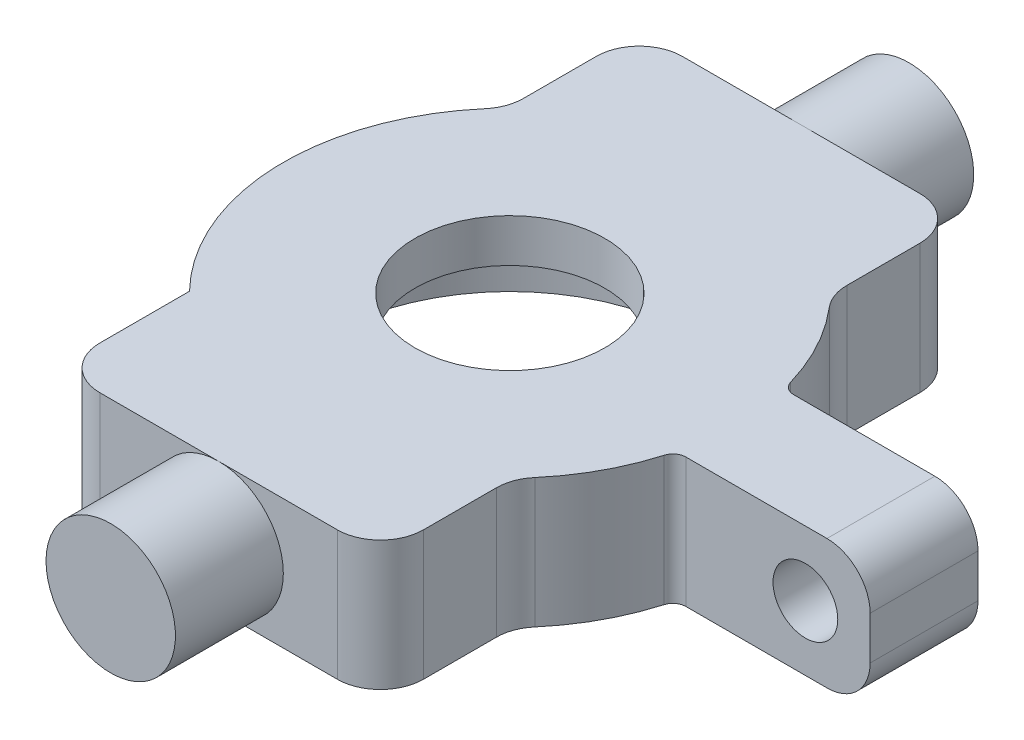
from build123d import *

# Parameters (mm, degrees)
BOSS_EXTRUDE1_DEPTH   = 6
BOSS_EXTRUDE1_2_DEPTH = 6
SKETCH1_3_R           = 10.5
SKETCH1_3_R_2         = 4.4
BOSS_EXTRUDE2_DEPTH   = 2
SKETCH2_R             = 8.575
BOSS_EXTRUDE3_DEPTH   = 4
SKETCH3_R             = 3
BOSS_EXTRUDE4_DEPTH   = 5
BOSS_EXTRUDE5_START   = -6
BOSS_EXTRUDE5_DEPTH   = 6
CUT_EXTRUDE1_REACH    = 31.079
SKETCH5_R             = 1.5
FILLET1_R             = 2
FILLET2_R             = 0.6


with BuildPart() as part:
    # Sketch1 → Boss-Extrude1 (new body)
    with BuildSketch(Plane(origin=(0, 0, 0), x_dir=(1, 0, 0), z_dir=(0, 1, 0))):
        with BuildLine():
            Line((-7.5, 13.5), (-7.5, 7.348469228))
            ThreePointArc((-7.5, 7.348469228), (0, 10.5), (7.5, 7.348469228))
            Line((7.5, 7.348469228), (7.5, 13.5))
            Line((7.5, 13.5), (-7.5, 13.5))
        make_face()
    extrude(amount=BOSS_EXTRUDE1_DEPTH)



with BuildPart() as body_2:
    # Sketch1 → Boss-Extrude1 2 (new body)
    with BuildSketch(Plane(origin=(0, 0, 0), x_dir=(1, 0, 0), z_dir=(0, 1, 0))):
        with BuildLine():
            ThreePointArc((7.5, -7.348469228), (0, -10.5), (-7.5, -7.348469228))
            Line((-7.5, -7.348469228), (-7.5, -13.5))
            Line((-7.5, -13.5), (7.5, -13.5))
            Line((7.5, -13.5), (7.5, -7.348469228))
        make_face()
    extrude(amount=BOSS_EXTRUDE1_2_DEPTH)


with BuildPart() as part_1:
    add(part.part)

    add(body_2.part)  # Boss-Extrude2 merges body 2
    # Sketch1<3> → Boss-Extrude2 (add)
    with BuildSketch(Plane(origin=(0, 0, 0), x_dir=(1, 0, 0), z_dir=(0, 1, 0))):
        Circle(SKETCH1_3_R)
        with Locations(Location((0, 0, 0), (0, 0, 270))):
            Circle(SKETCH1_3_R_2, mode=Mode.SUBTRACT)
    extrude(amount=BOSS_EXTRUDE2_DEPTH)

    # Sketch2 → Boss-Extrude3 (add)
    with BuildSketch(Plane(origin=(0, 2, 0), x_dir=(1, 0, 0), z_dir=(0, 1, 0))):
        with BuildLine():
            ThreePointArc((7.5, 7.348469228), (0, 10.5), (-7.5, 7.348469228))
            ThreePointArc((-7.5, 7.348469228), (-10.5, 0), (-7.5, -7.348469228))
            ThreePointArc((-7.5, -7.348469228), (0, -10.5), (7.5, -7.348469228))
            ThreePointArc((7.5, -7.348469228), (10.5, 0), (7.5, 7.348469228))
        make_face()
        with Locations(Location((0, 0, 0), (0, 0, 270))):
            Circle(SKETCH2_R, mode=Mode.SUBTRACT)
    extrude(amount=BOSS_EXTRUDE3_DEPTH)

    # Sketch3 → Boss-Extrude4 (add)
    with BuildSketch(Plane(origin=(0, 0, -13.5), x_dir=(-1, 0, 0), z_dir=(0, 0, -1))):
        with Locations(Location((0, 3, 0), (0, 0, 270))):
            Circle(SKETCH3_R)
    boss_extrude4 = extrude(amount=BOSS_EXTRUDE4_DEPTH)

    # Mirror1: Boss-Extrude4 across plane
    add(boss_extrude4.mirror(Plane.XY))

    # Sketch4 → Boss-Extrude5 (add)
    with BuildSketch(Plane(origin=(0, 6, 0), x_dir=(1, 0, 0), z_dir=(0, 1, 0)).offset(BOSS_EXTRUDE5_START)):
        with BuildLine():
            Line((10.198039027, -2.5), (19.198039027, -2.5))
            Line((19.198039027, -2.5), (19.198039027, 2.5))
            Line((19.198039027, 2.5), (10.198039027, 2.5))
            ThreePointArc((10.198039027, 2.5), (10.5, 0), (10.198039027, -2.5))
        make_face()
    extrude(amount=BOSS_EXTRUDE5_DEPTH)

    # Sketch5 → Cut-Extrude1 (cut, up to next)
    with BuildSketch(Plane(origin=(0, 0, -2.5), x_dir=(-1, 0, 0), z_dir=(0, 0, -1)), mode=Mode.PRIVATE) as cut_extrude1_sk1:
        with Locations((-16.198039027, 3)):
            Circle(SKETCH5_R)
    cut_extrude1_tool1 = extrude(cut_extrude1_sk1.sketch, amount=-CUT_EXTRUDE1_REACH, mode=Mode.PRIVATE) & part_1.part
    add(cut_extrude1_tool1.solids().sort_by_distance((16.198039, 3, -2.5))[0], mode=Mode.SUBTRACT)

    # Fillet1
    fillet1_edges = [part_1.edges().sort_by_distance(p)[0] for p in [
        (7.5, 3, 7.348469228),
        (-7.5, 3, 13.5),
        (7.5, 3, 13.5),
        (19.198039027, 6, 0),
        (19.198039027, 0, 0),
        (-7.5, 3, -7.348469228),
        (-7.5, 3, -13.5),
        (7.5, 3, -13.5),
        (7.5, 3, -7.348469228),
    ]]
    fillet(fillet1_edges, radius=FILLET1_R)

    # Fillet2
    fillet2_edges = [part_1.edges().sort_by_distance(p)[0] for p in [
        (10.198039027, 3, 2.5),
        (10.198039027, 3, -2.5),
    ]]
    fillet(fillet2_edges, radius=FILLET2_R)


with BuildPart() as body_2_2:
    # Mirror3: mirrored copy
    add(part_1.part.mirror(Plane.ZX.offset(16)))


solid = body_2_2.part
